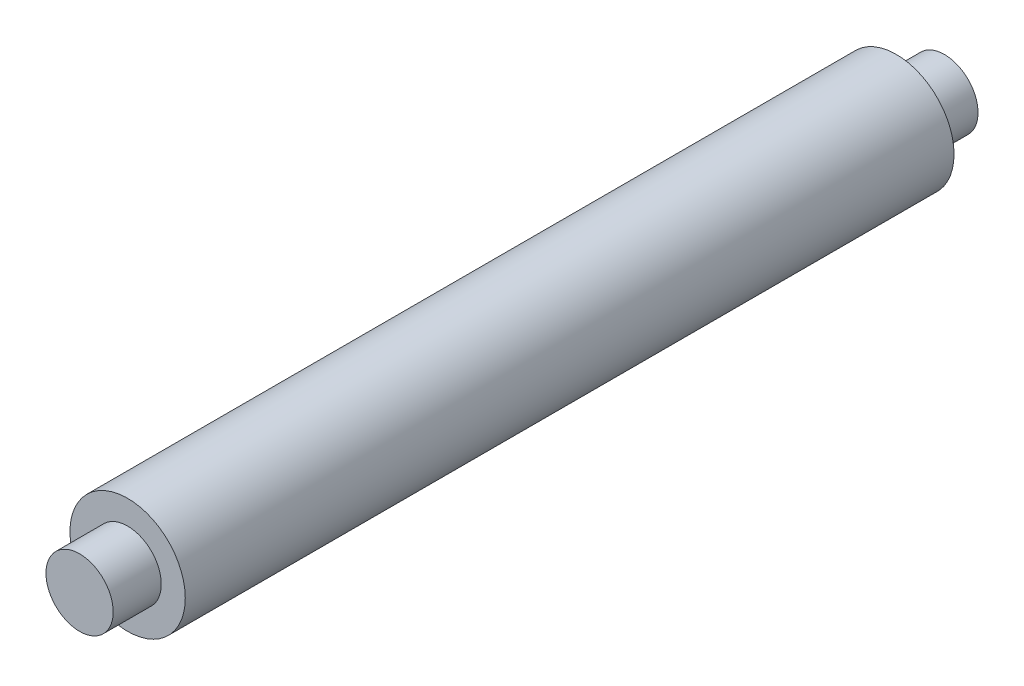
from build123d import *

# Parameters (mm, degrees)
CROQUIS1_R              = 24
SALIENTE_EXTRUIR1_DEPTH = 320
CROQUIS2_R              = 14
SALIENTE_EXTRUIR2_DEPTH = 20
SALIENTE_EXTRUIR3_START = 20
CROQUIS3_R              = 14
SALIENTE_EXTRUIR3_DEPTH = 20


with BuildPart() as part:
    # Croquis1 → Saliente-Extruir1 (new body)
    with BuildSketch(Plane.XY):
        Circle(CROQUIS1_R)
    extrude(amount=SALIENTE_EXTRUIR1_DEPTH)

    # Croquis2 → Saliente-Extruir2 (add)
    with BuildSketch(Plane(origin=(0, 0, 0), x_dir=(-1, 0, 0), z_dir=(0, 0, -1))):
        Circle(CROQUIS2_R)
    extrude(amount=SALIENTE_EXTRUIR2_DEPTH)

    # Croquis3 → Saliente-Extruir3 (add)
    with BuildSketch(Plane.XY.offset(320).offset(SALIENTE_EXTRUIR3_START)):
        with Locations(Location((0, 0, 0), (0, 0, 180))):
            Circle(CROQUIS3_R)
    extrude(amount=-SALIENTE_EXTRUIR3_DEPTH)


solid = part.part
